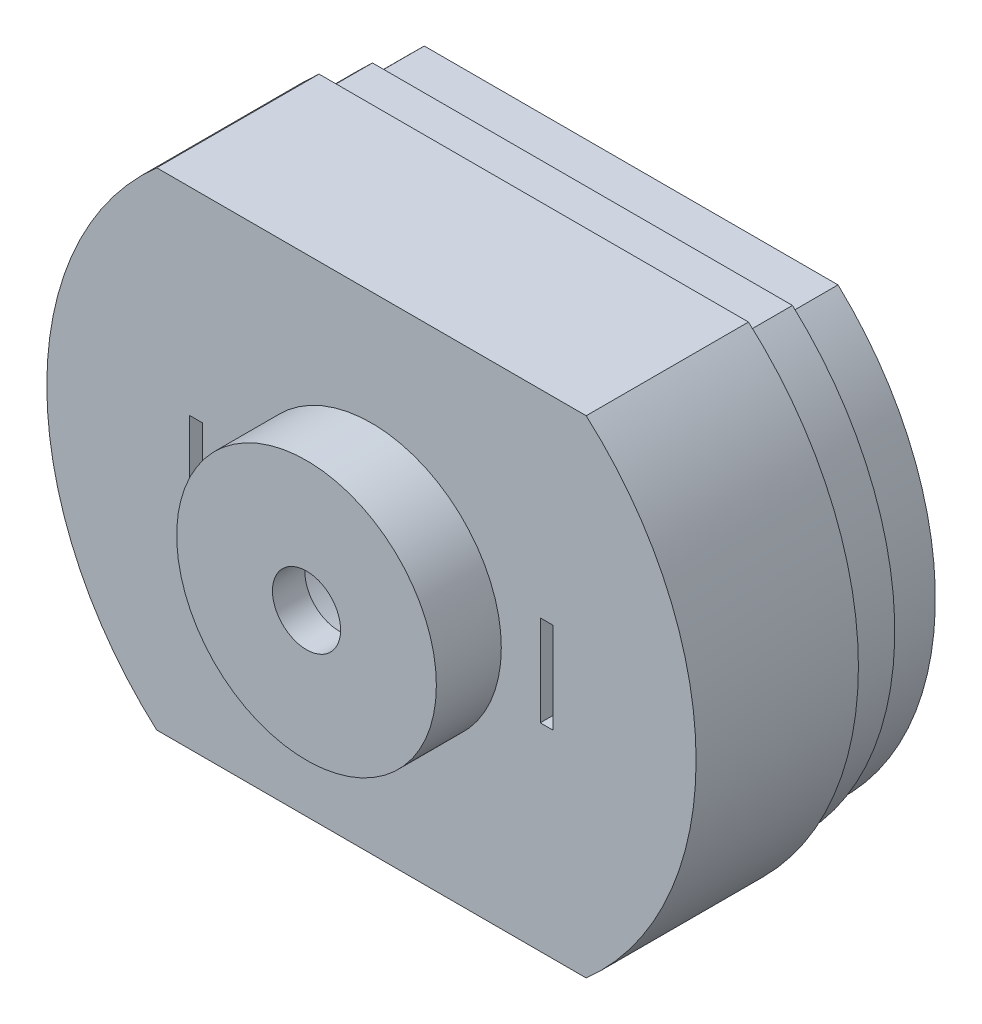
from build123d import *

# Parameters (mm, degrees)
BOSS_EXTRUDE1_DEPTH = 5
SKETCH2_R           = 4
BOSS_EXTRUDE2_DEPTH = 2
BOSS_EXTRUDE3_DEPTH = 1.5
BOSS_EXTRUDE4_DEPTH = 1.5
SKETCH5_W           = 12.75
SKETCH5_H           = 4
CUT_EXTRUDE1_DEPTH  = 6.5
SKETCH6_R           = 3
CUT_EXTRUDE2_DEPTH  = 2.5
SKETCH7_R           = 1.05
CUT_EXTRUDE3_DEPTH  = 2.5
SKETCH8_W           = 0.4
SKETCH8_H           = 2.8
CUT_EXTRUDE4_DEPTH  = 2.5


with BuildPart() as part:
    # Sketch1 → Boss-Extrude1 (new body)
    with BuildSketch(Plane.XY):
        with BuildLine():
            Line((-6.615, 7.5), (6.615, 7.5))
            ThreePointArc((6.615, 7.5), (10.000621722, 0), (6.615, -7.5))
            Line((6.615, -7.5), (-6.615, -7.5))
            ThreePointArc((-6.615, -7.5), (-10.000621722, 0), (-6.615, 7.5))
        make_face()
    extrude(amount=BOSS_EXTRUDE1_DEPTH)

    # Sketch2 → Boss-Extrude2 (add)
    with BuildSketch(Plane.XY.offset(5)):
        Circle(SKETCH2_R)
    extrude(amount=BOSS_EXTRUDE2_DEPTH)

    # Sketch3 → Boss-Extrude3 (add)
    with BuildSketch(Plane(origin=(0, 0, 0), x_dir=(-1, 0, 0), z_dir=(0, 0, -1))):
        with BuildLine():
            Line((-6.469779318, -7.12), (6.469779318, -7.12))
            ThreePointArc((6.469779318, -7.12), (9.620621722, 0), (6.469779318, 7.12))
            Line((6.469779318, 7.12), (-6.469779318, 7.12))
            ThreePointArc((-6.469779318, 7.12), (-9.620621722, 0), (-6.469779318, -7.12))
        make_face()
    extrude(amount=BOSS_EXTRUDE3_DEPTH)

    # Sketch4 → Boss-Extrude4 (add)
    with BuildSketch(Plane(origin=(0, 0, -1.5), x_dir=(-1, 0, 0), z_dir=(0, 0, -1))):
        with BuildLine():
            Line((-6.372434651, -6.87), (6.372434651, -6.87))
            ThreePointArc((6.372434651, -6.87), (9.370621722, 0), (6.372434651, 6.87))
            Line((6.372434651, 6.87), (-6.372434651, 6.87))
            ThreePointArc((-6.372434651, 6.87), (-9.370621722, 0), (-6.372434651, -6.87))
        make_face()
    extrude(amount=BOSS_EXTRUDE4_DEPTH)

    # Sketch5 → Cut-Extrude1 (cut)
    with BuildSketch(Plane(origin=(0, 0, -3), x_dir=(-1, 0, 0), z_dir=(0, 0, -1))):
        with BuildLine():
            Line((-6.374378278, -2), (-7.630621722, -4.995748192))
            ThreePointArc((-7.630621722, -4.995748192), (-6.9993793, -5.847374828), (-6.273579557, -6.62))
            Line((-6.273579557, -6.62), (6.273579557, -6.62))
            ThreePointArc((6.273579557, -6.62), (7.004508128, -5.841230625), (7.639378278, -4.982348672))
            Line((7.639378278, -4.982348672), (6.375621722, -2))
            Line((6.375621722, -2), (-6.374378278, -2))
        make_face()
        with Locations((0.000621722, 0)):
            Rectangle(SKETCH5_W, SKETCH5_H)
        with BuildLine():
            Line((6.375621722, 2), (7.639378278, 4.982348672))
            ThreePointArc((7.639378278, 4.982348672), (7.004508128, 5.841230625), (6.273579557, 6.62))
            Line((6.273579557, 6.62), (-6.273579557, 6.62))
            ThreePointArc((-6.273579557, 6.62), (-6.9993793, 5.847374828), (-7.630621722, 4.995748192))
            Line((-7.630621722, 4.995748192), (-6.374378278, 2))
            Line((-6.374378278, 2), (6.375621722, 2))
        make_face()
    extrude(amount=-CUT_EXTRUDE1_DEPTH, mode=Mode.SUBTRACT)

    # Sketch6 → Cut-Extrude2 (cut)
    with BuildSketch(Plane(origin=(0, 0, 3.5), x_dir=(-1, 0, 0), z_dir=(0, 0, -1))):
        Circle(SKETCH6_R)
    extrude(amount=-CUT_EXTRUDE2_DEPTH, mode=Mode.SUBTRACT)

    # Sketch7 → Cut-Extrude3 (cut)
    with BuildSketch(Plane(origin=(0, 0, 6), x_dir=(-1, 0, 0), z_dir=(0, 0, -1))):
        Circle(SKETCH7_R)
    extrude(amount=-CUT_EXTRUDE3_DEPTH, mode=Mode.SUBTRACT)

    # Sketch8 → Cut-Extrude4 (cut)
    with BuildSketch(Plane(origin=(0, 0, 3.5), x_dir=(-1, 0, 0), z_dir=(0, 0, -1))):
        with Locations((-5.4, 0)):
            Rectangle(SKETCH8_W, SKETCH8_H)
        with Locations((5.4, 0)):
            Rectangle(SKETCH8_W, SKETCH8_H)
    extrude(amount=-CUT_EXTRUDE4_DEPTH, mode=Mode.SUBTRACT)


solid = part.part
